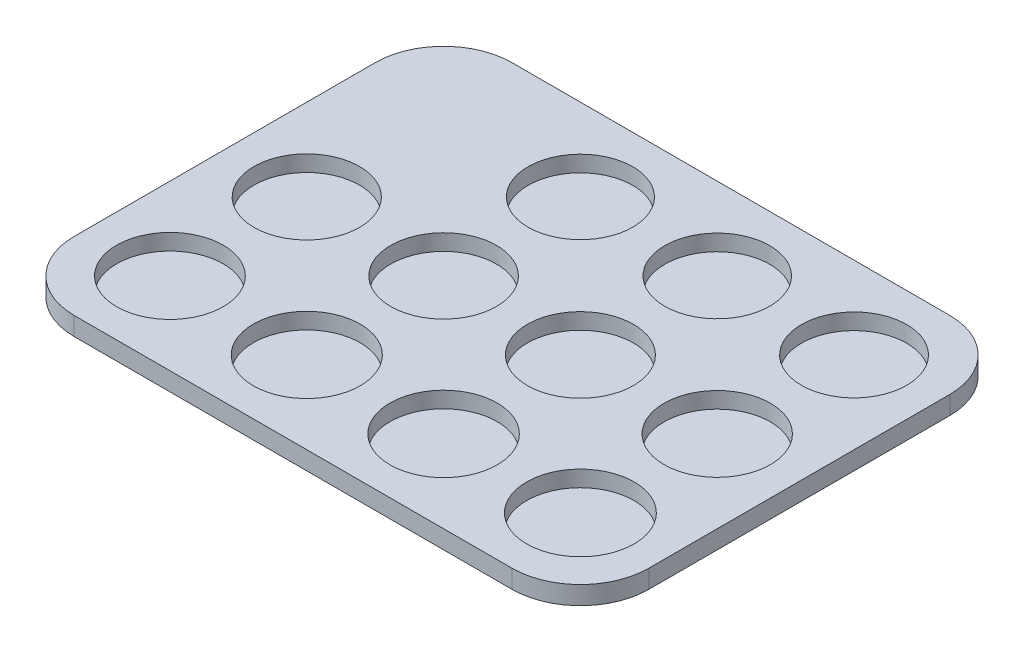
from build123d import *

# Parameters (mm, degrees)
SKETCH1_W           = 106.68
SKETCH1_H           = 81.28
SKETCH1_R           = 9.8
SKETCH1_R_2         = 9.825
SKETCH1_R_3         = 9.85
SKETCH1_R_4         = 9.875
SKETCH1_R_5         = 9.9
SKETCH1_R_6         = 9.925
SKETCH1_R_7         = 9.95
SKETCH1_R_8         = 9.975
SKETCH1_R_9         = 9.775
SKETCH1_R_10        = 9.75
SKETCH1_R_11        = 9.725
BOSS_EXTRUDE1_DEPTH = 3
SKETCH1_2_W         = 106.68
SKETCH1_2_H         = 81.28
BOSS_EXTRUDE2_DEPTH = 0.4
FILLET1_R           = 12.7


with BuildPart() as part:
    # Sketch1 → Boss-Extrude1 (new body)
    with BuildSketch(Plane(origin=(0, 0, 0), x_dir=(1, 0, 0), z_dir=(0, 1, 0))):
        with Locations((53.34, 40.64)):
            Rectangle(SKETCH1_W, SKETCH1_H)
        with Locations((15.24, 40.64)):
            Circle(SKETCH1_R, mode=Mode.SUBTRACT)
        with Locations((40.64, 40.64)):
            Circle(SKETCH1_R_2, mode=Mode.SUBTRACT)
        with Locations((66.04, 40.64)):
            Circle(SKETCH1_R_3, mode=Mode.SUBTRACT)
        with Locations((91.44, 40.64)):
            Circle(SKETCH1_R_4, mode=Mode.SUBTRACT)
        with Locations((15.24, 15.24)):
            Circle(SKETCH1_R_5, mode=Mode.SUBTRACT)
        with Locations((40.64, 15.24)):
            Circle(SKETCH1_R_6, mode=Mode.SUBTRACT)
        with Locations((66.04, 15.24)):
            Circle(SKETCH1_R_7, mode=Mode.SUBTRACT)
        with Locations((91.44, 15.24)):
            Circle(SKETCH1_R_8, mode=Mode.SUBTRACT)
        with Locations((91.44, 66.04)):
            Circle(SKETCH1_R_9, mode=Mode.SUBTRACT)
        with Locations((66.04, 66.04)):
            Circle(SKETCH1_R_10, mode=Mode.SUBTRACT)
        with Locations((40.64, 66.04)):
            Circle(SKETCH1_R_11, mode=Mode.SUBTRACT)
    extrude(amount=BOSS_EXTRUDE1_DEPTH)

    # Sketch1<2> → Boss-Extrude2 (add)
    with BuildSketch(Plane(origin=(0, 0, 0), x_dir=(1, 0, 0), z_dir=(0, 1, 0))):
        with Locations((53.34, 40.64)):
            Rectangle(SKETCH1_2_W, SKETCH1_2_H)
    extrude(amount=-BOSS_EXTRUDE2_DEPTH)

    # Fillet1
    fillet1_edges = [part.edges().sort_by_distance(p)[0] for p in [
        (0, 1.3, -81.28),
        (106.68, 1.3, -81.28),
        (106.68, 1.3, 0),
        (0, 1.3, 0),
    ]]
    fillet(fillet1_edges, radius=FILLET1_R)


solid = part.part
